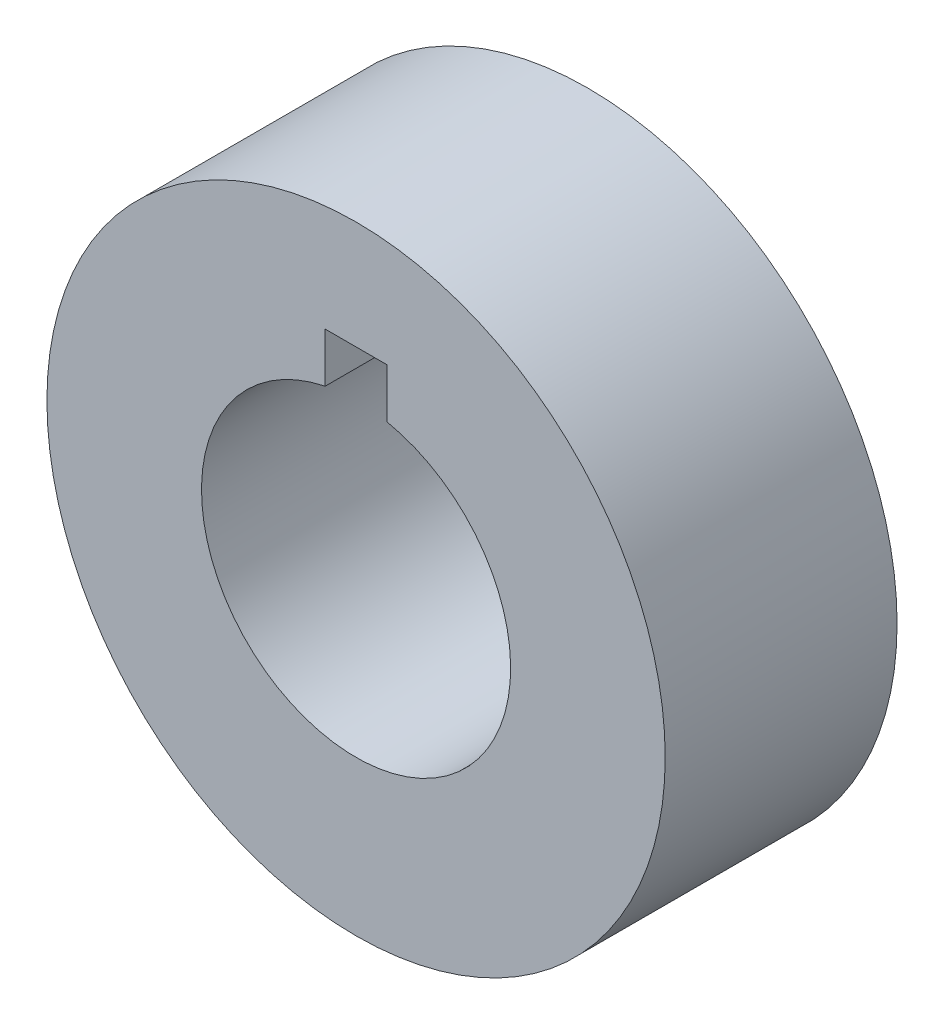
from build123d import *

# Parameters (mm, degrees)
SKETCH3_R           = 25.4
BOSS_EXTRUDE1_DEPTH = 19.05


with BuildPart() as part:
    # Sketch3 → Boss-Extrude1 (new body)
    with BuildSketch(Plane.XY):
        with Locations(Location((0, 0, 0), (0, 0, 180))):
            Circle(SKETCH3_R)
        with BuildLine():
            Line((-2.54, 16.51), (2.54, 16.51))
            Line((2.54, 16.51), (2.54, 12.443407893))
            ThreePointArc((2.54, 12.443407893), (0, -12.7), (-2.54, 12.443407893))
            Line((-2.54, 12.443407893), (-2.54, 16.51))
        make_face(mode=Mode.SUBTRACT)
    extrude(amount=BOSS_EXTRUDE1_DEPTH)


solid = part.part
